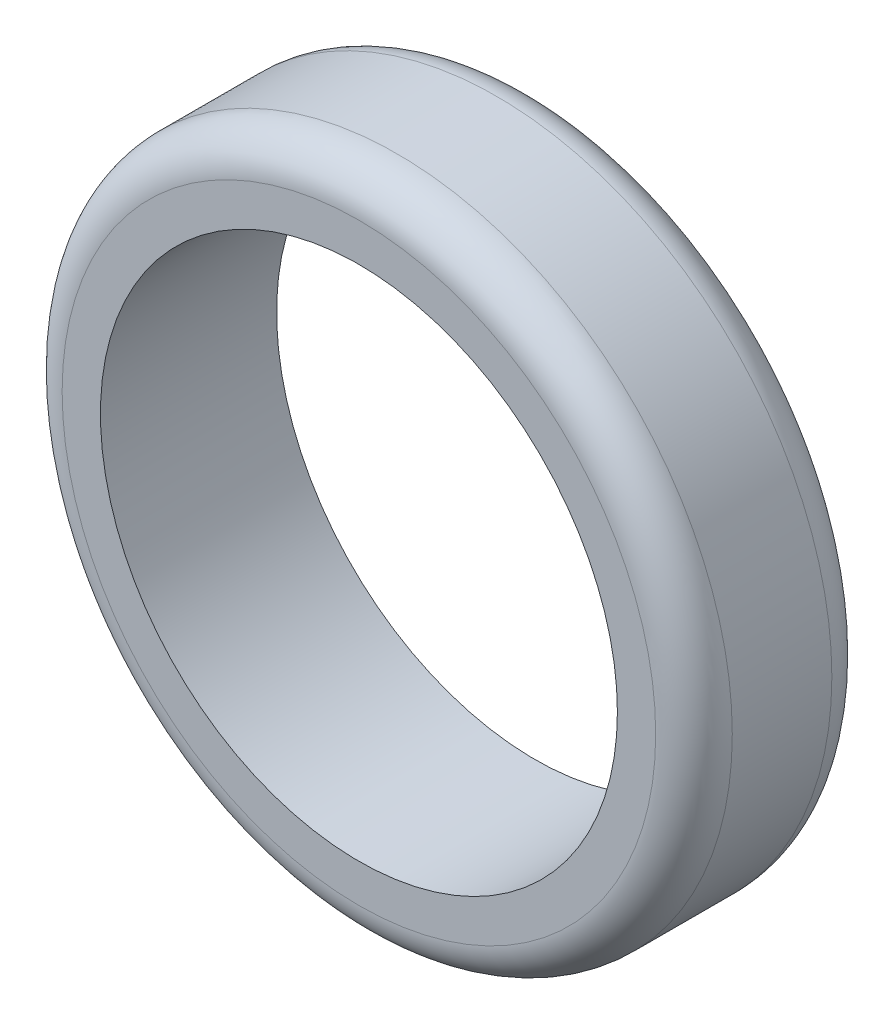
from build123d import *

# Parameters (mm, degrees)
SKETCH1_R           = 87.5
SKETCH1_R_2         = 67.5
BOSS_EXTRUDE1_DEPTH = 46
FILLET1_R           = 10


with BuildPart() as part:
    # Sketch1 → Boss-Extrude1 (new body)
    with BuildSketch(Plane.XY):
        Circle(SKETCH1_R)
        Circle(SKETCH1_R_2, mode=Mode.SUBTRACT)
    extrude(amount=BOSS_EXTRUDE1_DEPTH)

    # Fillet1
    fillet1_edges = [part.edges().sort_by_distance(p)[0] for p in [
        (-87.5, 0, 46),
        (-87.5, 0, 0),
    ]]
    fillet(fillet1_edges, radius=FILLET1_R)


solid = part.part
